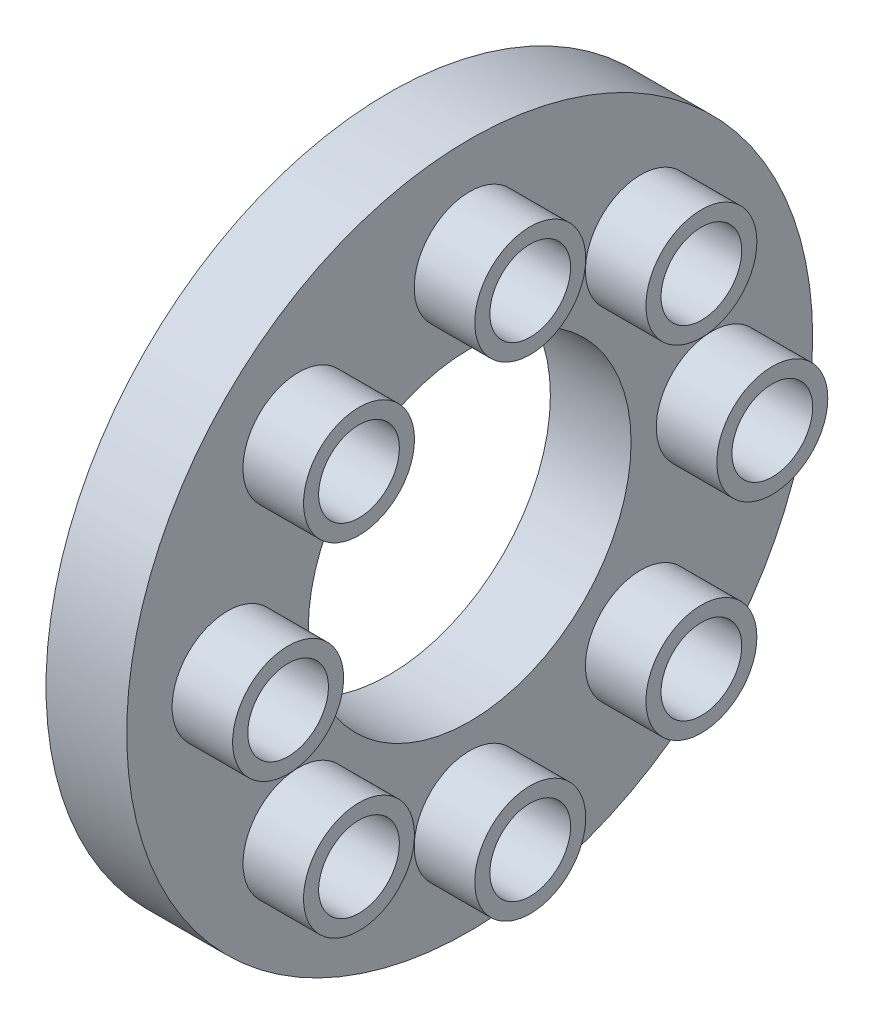
from build123d import *

# Parameters (mm, degrees)
SKETCH1_R           = 17
SKETCH1_R_2         = 2
SKETCH1_R_3         = 8
BOSS_EXTRUDE1_DEPTH = 4
SKETCH2_R           = 2.75
SKETCH2_R_2         = 2
BOSS_EXTRUDE2_DEPTH = 3


with BuildPart() as part:
    # Sketch1 → Boss-Extrude1 (new body)
    with BuildSketch(Plane(origin=(0, 0, 0), x_dir=(0, 0, -1), z_dir=(1, 0, 0))):
        Circle(SKETCH1_R)
        with Locations((0, 12)):
            Circle(SKETCH1_R_2, mode=Mode.SUBTRACT)
        with Locations((8.485281374, 8.485281374)):
            Circle(SKETCH1_R_2, mode=Mode.SUBTRACT)
        with Locations((12, 0)):
            Circle(SKETCH1_R_2, mode=Mode.SUBTRACT)
        with Locations((8.485281374, -8.485281374)):
            Circle(SKETCH1_R_2, mode=Mode.SUBTRACT)
        with Locations((0, -12)):
            Circle(SKETCH1_R_2, mode=Mode.SUBTRACT)
        with Locations((-8.485281374, -8.485281374)):
            Circle(SKETCH1_R_2, mode=Mode.SUBTRACT)
        with Locations((-12, 0)):
            Circle(SKETCH1_R_2, mode=Mode.SUBTRACT)
        with Locations((-8.485281374, 8.485281374)):
            Circle(SKETCH1_R_2, mode=Mode.SUBTRACT)
        Circle(SKETCH1_R_3, mode=Mode.SUBTRACT)
    extrude(amount=BOSS_EXTRUDE1_DEPTH)

    # Sketch2 → Boss-Extrude2 (add)
    # profile 1 of 8: a face of its own
    with BuildSketch(Plane(origin=(4, 0, 0), x_dir=(0, 0, -1), z_dir=(1, 0, 0))):
        with Locations((8.485281374, 8.485281374)):
            Circle(SKETCH2_R)
        with Locations((8.485281374, 8.485281374)):
            Circle(SKETCH2_R_2, mode=Mode.SUBTRACT)
    # profile 2 of 8: a face of its own
    with BuildSketch(Plane(origin=(4, 0, 0), x_dir=(0, 0, -1), z_dir=(1, 0, 0))):
        with Locations((12, 0)):
            Circle(SKETCH2_R)
        with Locations((12, 0)):
            Circle(SKETCH2_R_2, mode=Mode.SUBTRACT)
    # profile 3 of 8: a face of its own
    with BuildSketch(Plane(origin=(4, 0, 0), x_dir=(0, 0, -1), z_dir=(1, 0, 0))):
        with Locations((8.485281374, -8.485281374)):
            Circle(SKETCH2_R)
        with Locations((8.485281374, -8.485281374)):
            Circle(SKETCH2_R_2, mode=Mode.SUBTRACT)
    # profile 4 of 8: a face of its own
    with BuildSketch(Plane(origin=(4, 0, 0), x_dir=(0, 0, -1), z_dir=(1, 0, 0))):
        with Locations((0, -12)):
            Circle(SKETCH2_R)
        with Locations((0, -12)):
            Circle(SKETCH2_R_2, mode=Mode.SUBTRACT)
    # profile 5 of 8: a face of its own
    with BuildSketch(Plane(origin=(4, 0, 0), x_dir=(0, 0, -1), z_dir=(1, 0, 0))):
        with Locations((-8.485281374, -8.485281374)):
            Circle(SKETCH2_R)
        with Locations((-8.485281374, -8.485281374)):
            Circle(SKETCH2_R_2, mode=Mode.SUBTRACT)
    # profile 6 of 8: a face of its own
    with BuildSketch(Plane(origin=(4, 0, 0), x_dir=(0, 0, -1), z_dir=(1, 0, 0))):
        with Locations((-12, 0)):
            Circle(SKETCH2_R)
        with Locations((-12, 0)):
            Circle(SKETCH2_R_2, mode=Mode.SUBTRACT)
    # profile 7 of 8: a face of its own
    with BuildSketch(Plane(origin=(4, 0, 0), x_dir=(0, 0, -1), z_dir=(1, 0, 0))):
        with Locations((-8.485281374, 8.485281374)):
            Circle(SKETCH2_R)
        with Locations((-8.485281374, 8.485281374)):
            Circle(SKETCH2_R_2, mode=Mode.SUBTRACT)
    # profile 8 of 8: a face of its own
    with BuildSketch(Plane(origin=(4, 0, 0), x_dir=(0, 0, -1), z_dir=(1, 0, 0))):
        with Locations((0, 12)):
            Circle(SKETCH2_R)
        with Locations((0, 12)):
            Circle(SKETCH2_R_2, mode=Mode.SUBTRACT)
    extrude(amount=BOSS_EXTRUDE2_DEPTH)


solid = part.part
